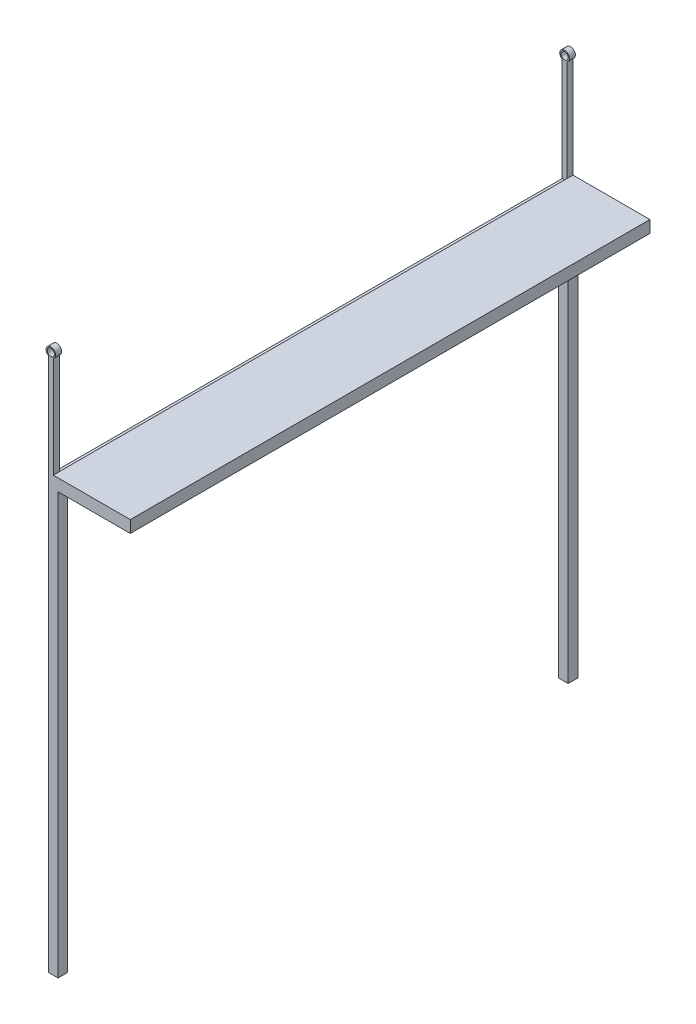
from build123d import *

# Parameters (mm, degrees)
SKETCH1_W               = 50.8
SKETCH1_H               = 2743.2
BOSS_EXTRUDE1_DEPTH     = 50.8
SKETCH2_R               = 19.05
BOSS_EXTRUDE2_DEPTH     = 31.75
SKETCH3_W               = 2743.2
SKETCH3_H               = 50.8
BOSS_EXTRUDE3_DEPTH     = 279.4
SKETCH4_W               = 279.4
SKETCH4_H               = 2743.2
BOSS_EXTRUDE4_DEPTH     = 12.7
SKETCH9_W               = 2743.2
SKETCH9_H               = 63.5
BOSS_EXTRUDE8_DEPTH     = 127
CUT_EXTRUDE1_DEPTH      = 2851.739581675
CUT_EXTRUDE1_DEPTH_BACK = 2851.739581675
SKETCH10_W              = 25.4
SKETCH10_H              = 50.8
SKETCH11_W              = 50.8
SKETCH11_H              = 50.8
BOSS_EXTRUDE9_DEPTH     = 2222.5


with BuildPart() as part:
    # Sketch1 → Boss-Extrude1 (new body)
    with BuildSketch(Plane(origin=(0, 0, 0), x_dir=(1, 0, 0), z_dir=(0, 1, 0))):
        Rectangle(SKETCH1_W, SKETCH1_H)
    extrude(amount=BOSS_EXTRUDE1_DEPTH)

    # Sketch2 → Boss-Extrude2 (add)
    with BuildSketch(Plane.XY.offset(1371.6)):
        with BuildLine():
            Line((0, 50.8), (25.4, 50.8))
            Line((25.4, 50.8), (25.4, 596.9))
            ThreePointArc((25.4, 596.9), (12.7, 644.297045256), (0, 596.9))
            Line((0, 596.9), (0, 50.8))
        make_face()
        with Locations((12.7, 618.897045256)):
            Circle(SKETCH2_R, mode=Mode.SUBTRACT)
    boss_extrude2 = extrude(amount=-BOSS_EXTRUDE2_DEPTH)

    # Mirror1: Boss-Extrude2 across plane
    add(boss_extrude2.mirror(Plane.XY))

    # Sketch3 → Boss-Extrude3 (add)
    with BuildSketch(Plane(origin=(25.4, 0, 0), x_dir=(0, 0, -1), z_dir=(1, 0, 0))):
        with Locations((0, 25.4)):
            Rectangle(SKETCH3_W, SKETCH3_H)
    extrude(amount=BOSS_EXTRUDE3_DEPTH)

    # Sketch4 → Boss-Extrude4 (add)
    with BuildSketch(Plane(origin=(0, 50.8, 0), x_dir=(1, 0, 0), z_dir=(0, 1, 0))):
        with Locations((165.1, 0)):
            Rectangle(SKETCH4_W, SKETCH4_H)
    extrude(amount=BOSS_EXTRUDE4_DEPTH)

    # Sketch9 → Boss-Extrude8 (add)
    with BuildSketch(Plane(origin=(304.8, 0, 0), x_dir=(0, 0, -1), z_dir=(1, 0, 0))):
        with Locations((0, 31.75)):
            Rectangle(SKETCH9_W, SKETCH9_H)
    extrude(amount=BOSS_EXTRUDE8_DEPTH)

    # Sketch10 → Cut-Extrude1 (cut, two sides: drawn at the far end of the back side and taken through both)
    with BuildSketch(Plane.XY.offset(1371.6).offset(-CUT_EXTRUDE1_DEPTH_BACK)):
        with Locations((-12.7, 25.4)):
            Rectangle(SKETCH10_W, SKETCH10_H)
    extrude(amount=CUT_EXTRUDE1_DEPTH + CUT_EXTRUDE1_DEPTH_BACK, mode=Mode.SUBTRACT)

    # Sketch11 → Boss-Extrude9 (add)
    with BuildSketch(Plane.XZ):
        with Locations((25.4, 1346.2)):
            Rectangle(SKETCH11_W, SKETCH11_H)
        with Locations((25.4, -1346.2)):
            Rectangle(SKETCH11_W, SKETCH11_H)
    extrude(amount=BOSS_EXTRUDE9_DEPTH)


solid = part.part
